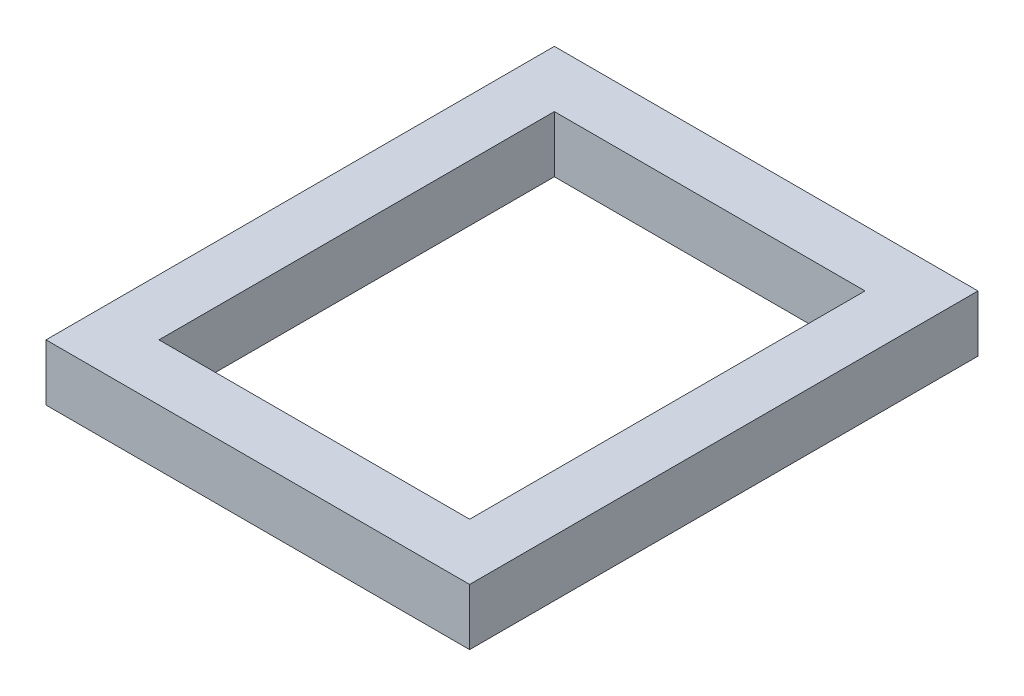
from build123d import *

# Parameters (mm, degrees)
SKETCH1_W           = 95.25
SKETCH1_H           = 114.3
SKETCH1_W_2         = 69.85
SKETCH1_H_2         = 88.9
BOSS_EXTRUDE1_DEPTH = 12.7


with BuildPart() as part:
    # Sketch1 → Boss-Extrude1 (new body)
    with BuildSketch(Plane(origin=(0, 0, 0), x_dir=(1, 0, 0), z_dir=(0, 1, 0))):
        Rectangle(SKETCH1_W, SKETCH1_H)
        Rectangle(SKETCH1_W_2, SKETCH1_H_2, mode=Mode.SUBTRACT)
    extrude(amount=BOSS_EXTRUDE1_DEPTH)


solid = part.part
